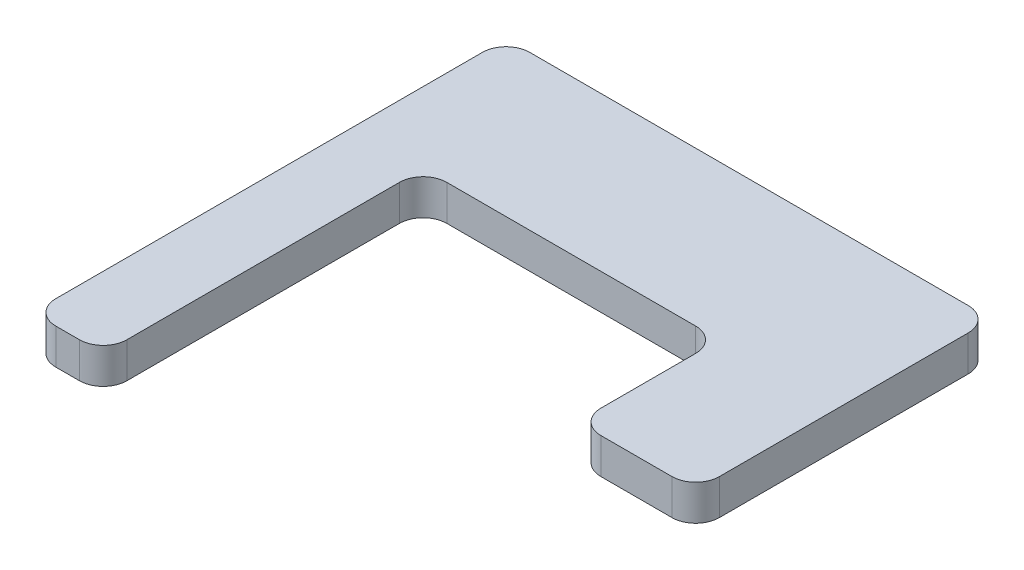
from build123d import *

# Parameters (mm, degrees)
BOSS_EXTRUDE1_DEPTH = 3
FILLET1_R           = 2


with BuildPart() as part:
    # Sketch1 → Boss-Extrude1 (new body)
    with BuildSketch(Plane(origin=(0, 0, 0), x_dir=(1, 0, 0), z_dir=(0, 1, 0))):
        Polygon((-19.348873447, 6.013358482), (21.651126553, 6.013358482), (21.651126553, -18.986641518), (11.651126553, -18.986641518), (11.651126553, -6.986641518), (-13.348873447, -6.986641518), (-13.348873447, -33.986641518), (-19.348873447, -33.986641518), align=None)
    extrude(amount=BOSS_EXTRUDE1_DEPTH)

    # Fillet1
    fillet1_edges = [part.edges().sort_by_distance(p)[0] for p in [
        (-19.348873447, 1.5, -6.013358482),
        (21.651126553, 1.5, -6.013358482),
        (21.651126553, 1.5, 18.986641518),
        (11.651126553, 1.5, 18.986641518),
        (11.651126553, 1.5, 6.986641518),
        (-13.348873447, 1.5, 6.986641518),
        (-13.348873447, 1.5, 33.986641518),
        (-19.348873447, 1.5, 33.986641518),
    ]]
    fillet(fillet1_edges, radius=FILLET1_R)


solid = part.part
